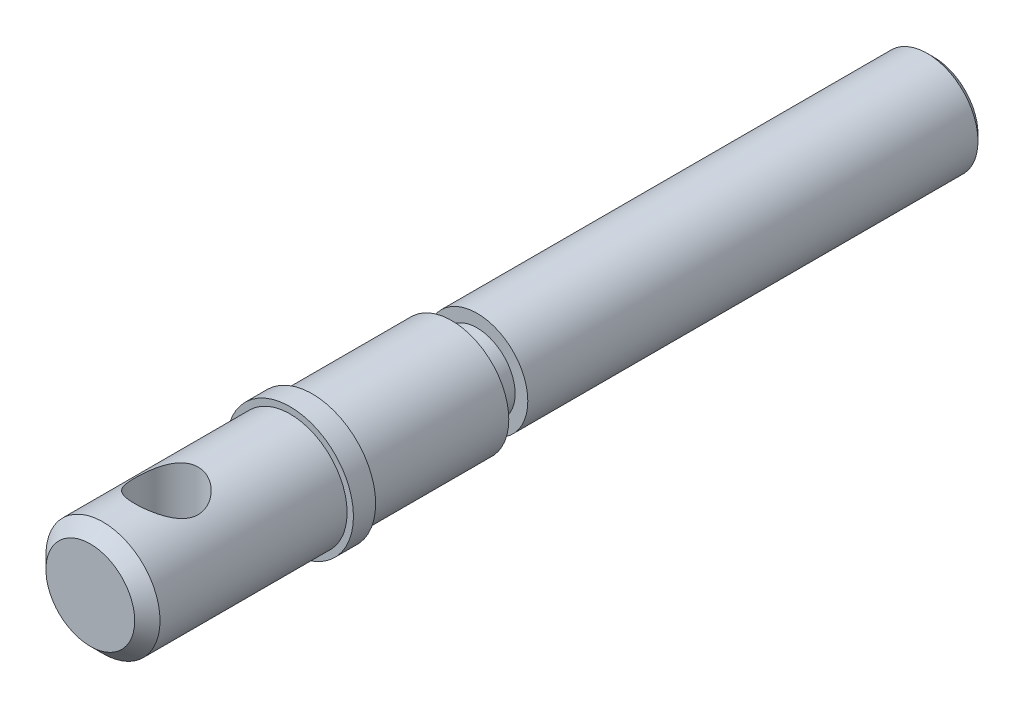
from build123d import *

# Parameters (mm, degrees)
ESQUISSE2_R                  = 8
BOSS_EXTRU_1_DEPTH           = 72
ESQUISSE3_R                  = 6
BOSS_EXTRU_2_DEPTH           = 4
ESQUISSE4_R                  = 9
BOSS_EXTRU_3_DEPTH           = 22
ESQUISSE5_R                  = 10
BOSS_EXTRU_4_DEPTH           = 3.5
ESQUISSE6_R                  = 9
BOSS_EXTRU_5_DEPTH           = 31.5
CHANFREIN1_SIZE              = 2
CHANFREIN2_SIZE              = 1
ENL_V_MAT_EXTRU_1_DEPTH      = 134.749766355
ENL_V_MAT_EXTRU_1_DEPTH_BACK = 134.749766355
ESQUISSE7_R                  = 5


with BuildPart() as part:
    # Esquisse2 → Boss.-Extru.1 (new body)
    with BuildSketch(Plane.XY):
        Circle(ESQUISSE2_R)
    extrude(amount=BOSS_EXTRU_1_DEPTH)

    # Esquisse3 → Boss.-Extru.2 (add)
    with BuildSketch(Plane.XY.offset(72)):
        Circle(ESQUISSE3_R)
    extrude(amount=BOSS_EXTRU_2_DEPTH)

    # Esquisse4 → Boss.-Extru.3 (add)
    with BuildSketch(Plane.XY.offset(76)):
        Circle(ESQUISSE4_R)
    extrude(amount=BOSS_EXTRU_3_DEPTH)

    # Esquisse5 → Boss.-Extru.4 (add)
    with BuildSketch(Plane.XY.offset(98)):
        Circle(ESQUISSE5_R)
    extrude(amount=BOSS_EXTRU_4_DEPTH)

    # Esquisse6 → Boss.-Extru.5 (add)
    with BuildSketch(Plane.XY.offset(101.5)):
        Circle(ESQUISSE6_R)
    extrude(amount=BOSS_EXTRU_5_DEPTH)

    # Chanfrein1
    chanfrein1_edges = [part.edges().sort_by_distance(p)[0] for p in [
        (-9, 0, 133),
    ]]
    chamfer(chanfrein1_edges, length=CHANFREIN1_SIZE)

    # Chanfrein2
    chanfrein2_edges = [part.edges().sort_by_distance(p)[0] for p in [
        (-8, 0, 0),
    ]]
    chamfer(chanfrein2_edges, length=CHANFREIN2_SIZE)

    # Esquisse7 → Enlèv. mat.-Extru.1 (cut, two sides: drawn at the far end of the back side and taken through both)
    with BuildSketch(Plane(origin=(0, 0, 0), x_dir=(1, 0, 0), z_dir=(0, 1, 0)).offset(-ENL_V_MAT_EXTRU_1_DEPTH_BACK)):
        with Locations(Location((0, -121, 0), (0, 0, 270))):
            Circle(ESQUISSE7_R)
    extrude(amount=ENL_V_MAT_EXTRU_1_DEPTH + ENL_V_MAT_EXTRU_1_DEPTH_BACK, mode=Mode.SUBTRACT)


solid = part.part
